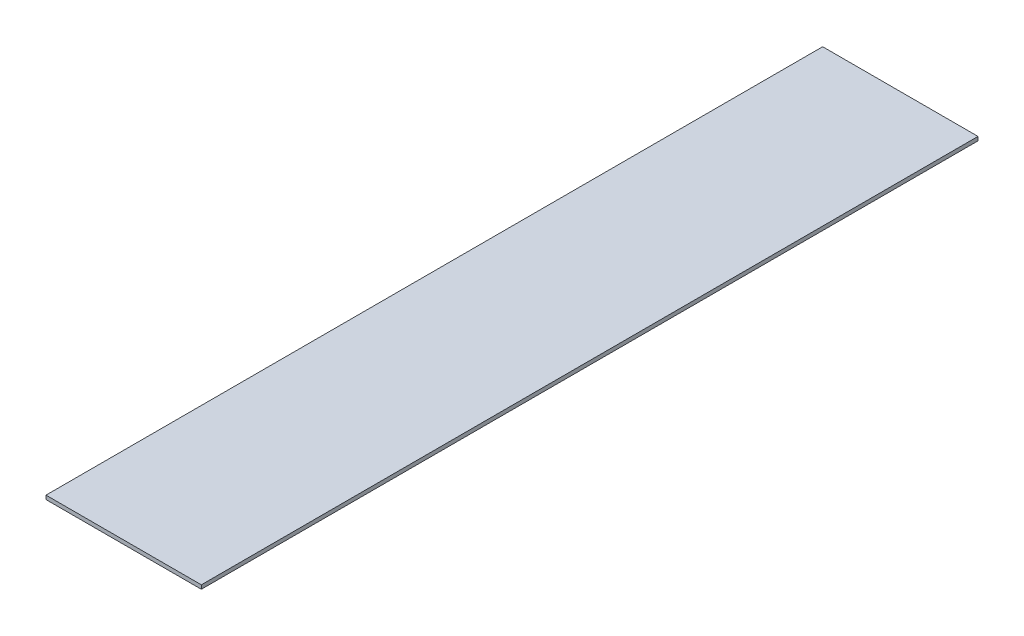
from build123d import *

# Parameters (mm, degrees)
SKETCH2_W           = 120
SKETCH2_H           = 600
BOSS_EXTRUDE1_DEPTH = 3


with BuildPart() as part:
    # Sketch2 → Boss-Extrude1 (new body)
    with BuildSketch(Plane(origin=(0, 0, 0), x_dir=(1, 0, 0), z_dir=(0, 1, 0))):
        Rectangle(SKETCH2_W, SKETCH2_H)
    extrude(amount=BOSS_EXTRUDE1_DEPTH)


solid = part.part
